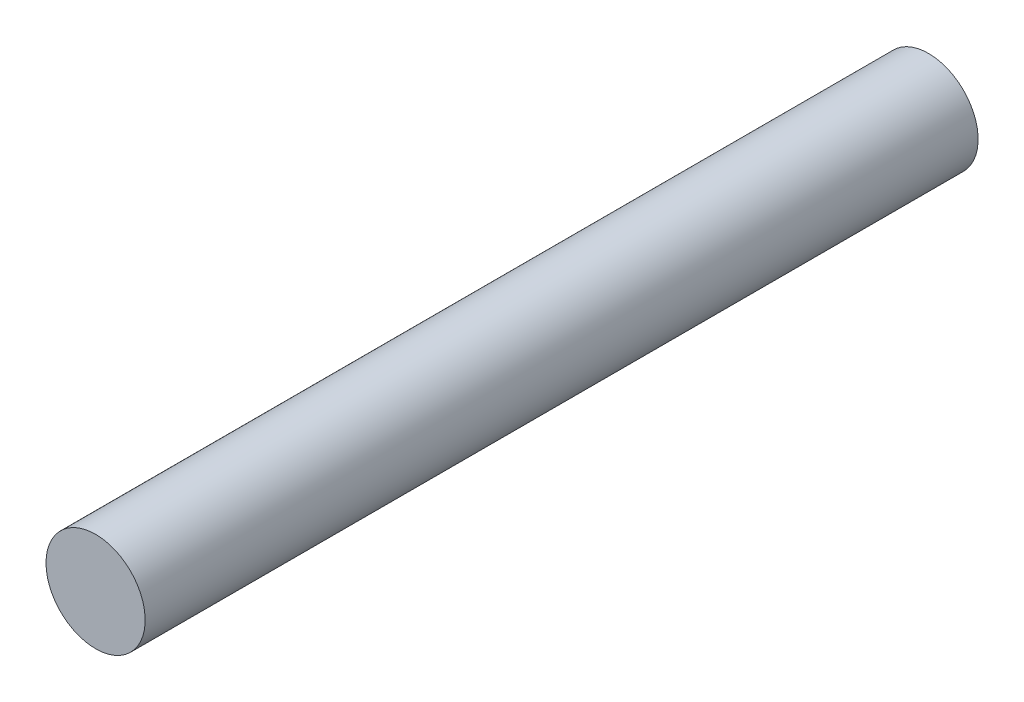
from build123d import *

# Parameters (mm, degrees)
SKETCH1_R           = 2.5
BOSS_EXTRUDE1_DEPTH = 42


with BuildPart() as part:
    # Sketch1 → Boss-Extrude1 (new body)
    with BuildSketch(Plane.XY):
        with Locations(Location((0, 0, 0), (0, 0, 180))):
            Circle(SKETCH1_R)
    extrude(amount=BOSS_EXTRUDE1_DEPTH)


solid = part.part
